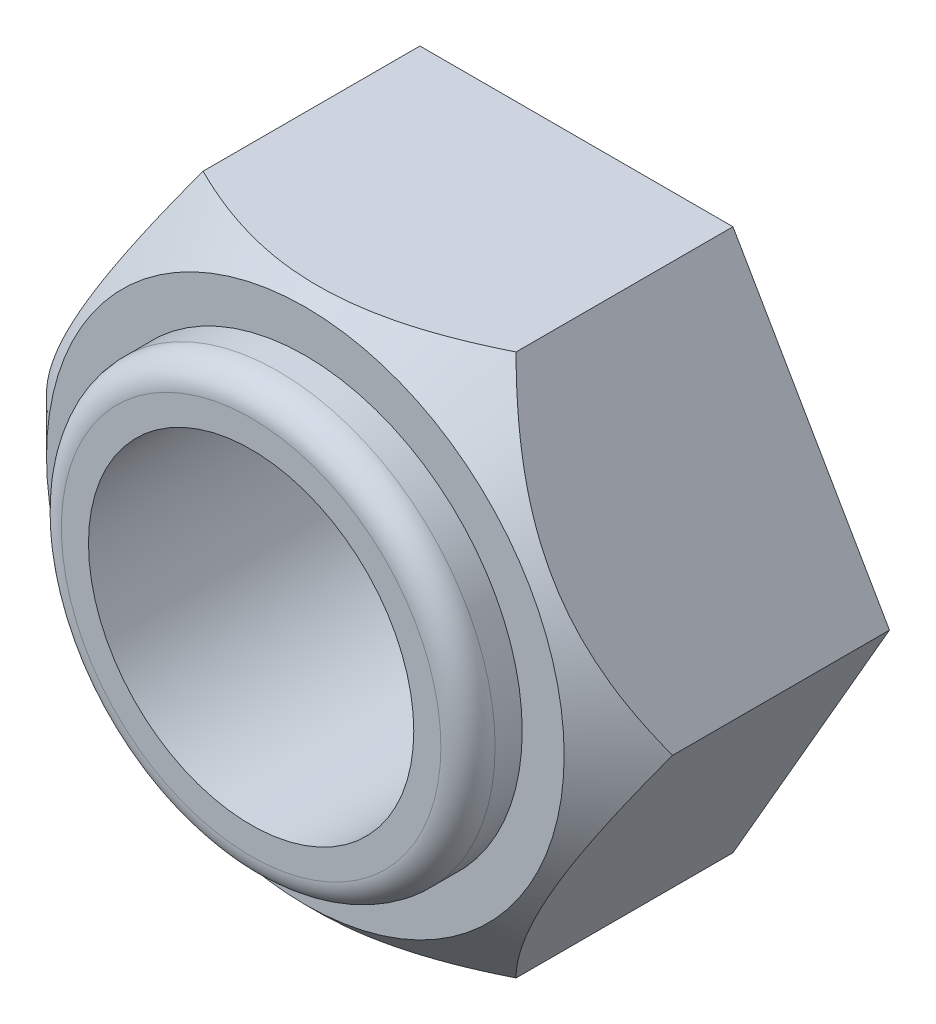
from build123d import *

# Parameters (mm, degrees)
EXTRUDE_1_DEPTH     = 5
SKETCH_2_R          = 4
EXTRUDE_2_DEPTH     = 1
SKETCH_2_3_R        = 3
CUT_EXTRUDE_1_DEPTH = 5.5
FILLET_3_R          = 0.5


with BuildPart() as part:
    # 草图1 → 凸台-拉伸1 (new body)
    with BuildSketch(Plane.XY):
        Polygon((5.773502692, 0), (2.886751346, 5), (-2.886751346, 5), (-5.773502692, 0), (-2.886751346, -5), (2.886751346, -5), align=None)
    extrude(amount=EXTRUDE_1_DEPTH)

    # 草图2 → 凸台-拉伸2 (add)
    with BuildSketch(Plane.XY.offset(5)):
        Circle(SKETCH_2_R)
    extrude(amount=EXTRUDE_2_DEPTH)

    # 草图2<3> → 切除-拉伸1 (cut, symmetric)
    with BuildSketch(Plane.XY.offset(5)):
        Circle(SKETCH_2_3_R)
    extrude(amount=CUT_EXTRUDE_1_DEPTH, both=True, mode=Mode.SUBTRACT)

    # 草图3 → 切除-旋转1 (revolve, cut)
    with BuildSketch(Plane(origin=(0, 0, 0), x_dir=(1, 0, 0), z_dir=(0, 1, 0))):
        Polygon((-5.773502692, -5), (-5.773502692, -4), (-4.773502692, -5), align=None)
    revolve(axis=Axis((0, 0, 0), (0, 0, -1)), mode=Mode.SUBTRACT)

    # 圆角3
    fillet_3_edges = [part.edges().sort_by_distance(p)[0] for p in [
        (-4, 0, 6),
    ]]
    fillet(fillet_3_edges, radius=FILLET_3_R)


solid = part.part
